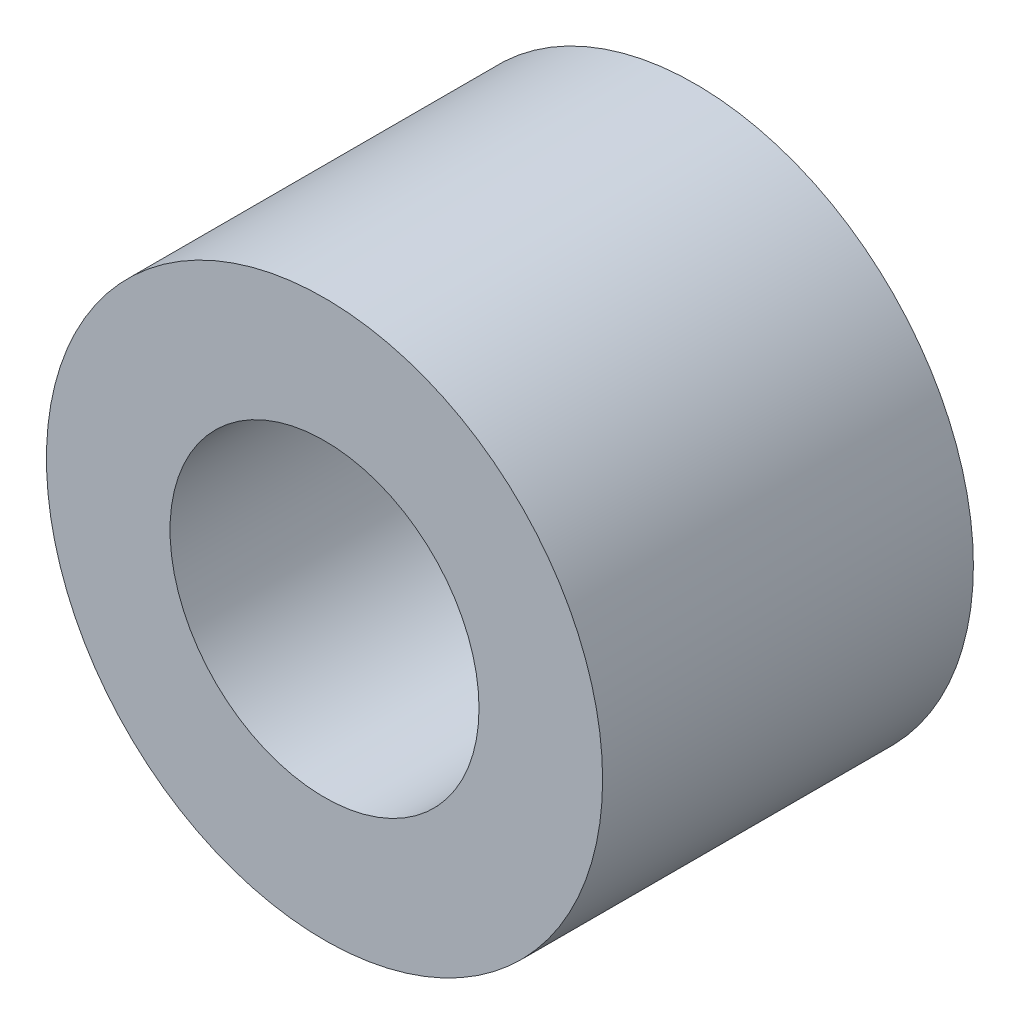
from build123d import *

# Parameters (mm, degrees)
ESBO_O1_R                = 4.5
ESBO_O1_R_2              = 2.5
RESSALTO_EXTRUS_O1_DEPTH = 6


with BuildPart() as part:
    # Esboço1 → Ressalto-extrusão1 (new body)
    with BuildSketch(Plane.XY):
        Circle(ESBO_O1_R)
        Circle(ESBO_O1_R_2, mode=Mode.SUBTRACT)
    extrude(amount=RESSALTO_EXTRUS_O1_DEPTH)


solid = part.part
